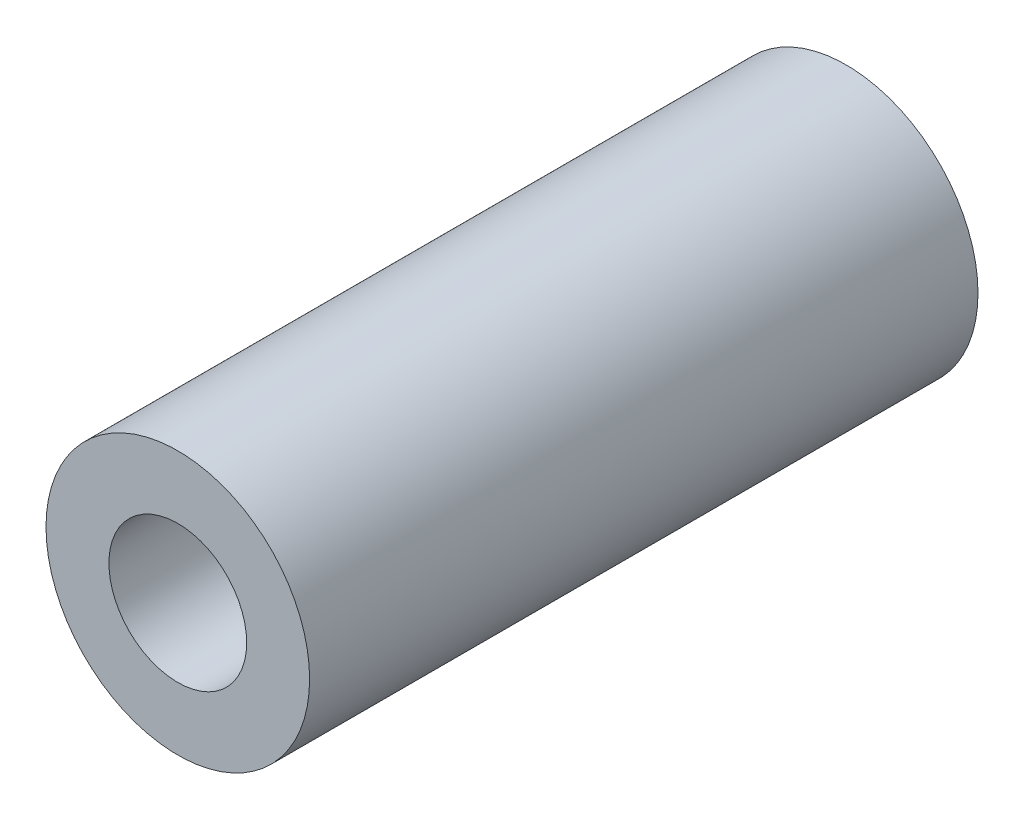
from build123d import *

# Parameters (mm, degrees)
SKETCH1_R           = 4.7625
SKETCH1_R_2         = 2.4892
BOSS_EXTRUDE1_DEPTH = 12.07516


with BuildPart() as part:
    # Sketch1 → Boss-Extrude1 (new, symmetric)
    with BuildSketch(Plane.XY):
        Circle(SKETCH1_R)
        Circle(SKETCH1_R_2, mode=Mode.SUBTRACT)
    extrude(amount=BOSS_EXTRUDE1_DEPTH, both=True)


solid = part.part
